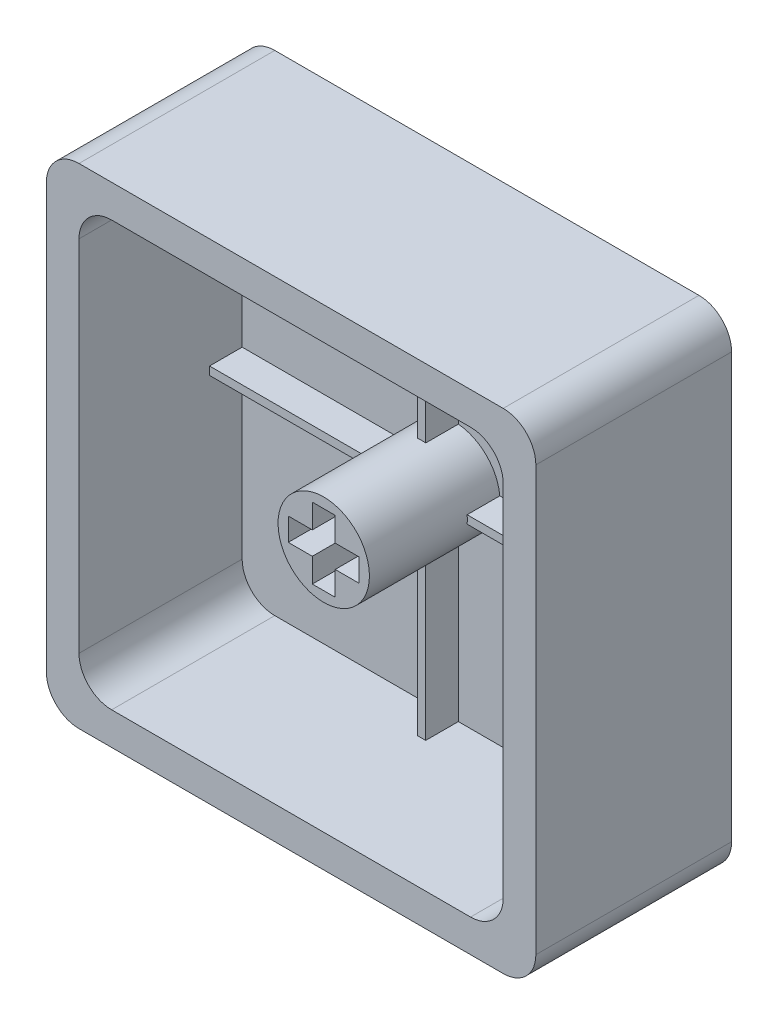
from build123d import *

# Parameters (mm, degrees)
EXTRUDE_1_DEPTH = 10
EXTRUDE_2_DEPTH = 8
EXTRUDE_START   = -2
EXTRUDE_3_DEPTH = 2
EXTRUDE_4_DEPTH = 2


with BuildPart() as part:
    # 草图1 → 凸台-拉伸1 (new body)
    with BuildSketch(Plane.XY):
        with BuildLine():
            Line((13, 15), (-13, 15))
            ThreePointArc((-13, 15), (-14.414213562, 14.414213562), (-15, 13))
            Line((-15, 13), (-15, -13))
            ThreePointArc((-15, -13), (-14.414213562, -14.414213562), (-13, -15))
            Line((-13, -15), (13, -15))
            ThreePointArc((13, -15), (14.414213562, -14.414213562), (15, -13))
            Line((15, -13), (15, 13))
            ThreePointArc((15, 13), (14.414213562, 14.414213562), (13, 15))
        make_face()
        with BuildLine():
            ThreePointArc((-13, 11), (-12.414213562, 12.414213562), (-11, 13))
            Line((-11, 13), (-0.25, 13))
            Line((-0.25, 13), (0.25, 13))
            Line((0.25, 13), (11, 13))
            ThreePointArc((11, 13), (12.414213562, 12.414213562), (13, 11))
            Line((13, 11), (13, 0.25))
            Line((13, 0.25), (13, -0.25))
            Line((13, -0.25), (13, -11))
            ThreePointArc((13, -11), (12.414213562, -12.414213562), (11, -13))
            Line((11, -13), (0.25, -13))
            Line((0.25, -13), (-0.25, -13))
            Line((-0.25, -13), (-11, -13))
            ThreePointArc((-11, -13), (-12.414213562, -12.414213562), (-13, -11))
            Line((-13, -11), (-13, -0.25))
            Line((-13, -0.25), (-13, 0.25))
            Line((-13, 0.25), (-13, 11))
        make_face(mode=Mode.SUBTRACT)
    extrude(amount=EXTRUDE_1_DEPTH)



with BuildPart() as body_2:
    # 草图1<6> → 凸台-拉伸2 (new body)
    with BuildSketch(Plane.XY):
        with BuildLine():
            ThreePointArc((0.25, 2.788816953), (0, 2.8), (-0.25, 2.788816953))
            ThreePointArc((-0.25, 2.788816953), (-1.979898987, 1.979898987), (-2.788816953, 0.25))
            ThreePointArc((-2.788816953, 0.25), (-2.8, 0), (-2.788816953, -0.25))
            ThreePointArc((-2.788816953, -0.25), (-1.979898987, -1.979898987), (-0.25, -2.788816953))
            ThreePointArc((-0.25, -2.788816953), (0, -2.8), (0.25, -2.788816953))
            ThreePointArc((0.25, -2.788816953), (1.979898987, -1.979898987), (2.788816953, -0.25))
            ThreePointArc((2.788816953, -0.25), (2.797202841, -0.125124998), (2.8, 0))
            ThreePointArc((2.8, 0), (2.797202841, 0.125124998), (2.788816953, 0.25))
            ThreePointArc((2.788816953, 0.25), (1.979898987, 1.979898987), (0.25, 2.788816953))
        make_face()
        Polygon((-2.175, -0.7), (-2.175, 0.7), (-0.7, 0.7), (-0.7, 2.175), (0.7, 2.175), (0.7, 0.7), (2.175, 0.7), (2.175, -0.7), (0.7, -0.7), (0.7, -2.175), (-0.7, -2.175), (-0.7, -0.7), align=None, mode=Mode.SUBTRACT)
    extrude(amount=EXTRUDE_2_DEPTH)


with BuildPart() as part_1:
    add(part.part)

    add(body_2.part)  # 凸台-拉伸3 merges body 2
    # 草图1<7> → 凸台-拉伸3 (add)
    with BuildSketch(Plane.XY.offset(EXTRUDE_START)):
        with BuildLine():
            Line((-13, 15), (13, 15))
            ThreePointArc((13, 15), (14.414213562, 14.414213562), (15, 13))
            Line((15, 13), (15, -13))
            ThreePointArc((15, -13), (14.414213562, -14.414213562), (13, -15))
            Line((13, -15), (-13, -15))
            ThreePointArc((-13, -15), (-14.414213562, -14.414213562), (-15, -13))
            Line((-15, -13), (-15, 13))
            ThreePointArc((-15, 13), (-14.414213562, 14.414213562), (-13, 15))
        make_face()
    extrude(amount=EXTRUDE_3_DEPTH)

    # 草图1<9> → 凸台-拉伸4 (add)
    with BuildSketch(Plane.XY):
        with BuildLine():
            Line((0.25, 13), (-0.25, 13))
            Line((-0.25, 13), (-0.25, 2.788816953))
            ThreePointArc((-0.25, 2.788816953), (0, 2.8), (0.25, 2.788816953))
            Line((0.25, 2.788816953), (0.25, 13))
        make_face()
        with BuildLine():
            Line((-2.788816953, 0.25), (-13, 0.25))
            Line((-13, 0.25), (-13, -0.25))
            Line((-13, -0.25), (-2.788816953, -0.25))
            ThreePointArc((-2.788816953, -0.25), (-2.8, 0), (-2.788816953, 0.25))
        make_face()
        with BuildLine():
            Line((13, 0.25), (2.788816953, 0.25))
            ThreePointArc((2.788816953, 0.25), (2.8, 0), (2.788816953, -0.25))
            Line((2.788816953, -0.25), (13, -0.25))
            Line((13, -0.25), (13, 0.25))
        make_face()
        with BuildLine():
            ThreePointArc((0.25, -2.788816953), (0, -2.8), (-0.25, -2.788816953))
            Line((-0.25, -2.788816953), (-0.25, -13))
            Line((-0.25, -13), (0.25, -13))
            Line((0.25, -13), (0.25, -2.788816953))
        make_face()
    extrude(amount=EXTRUDE_4_DEPTH)


solid = part_1.part
